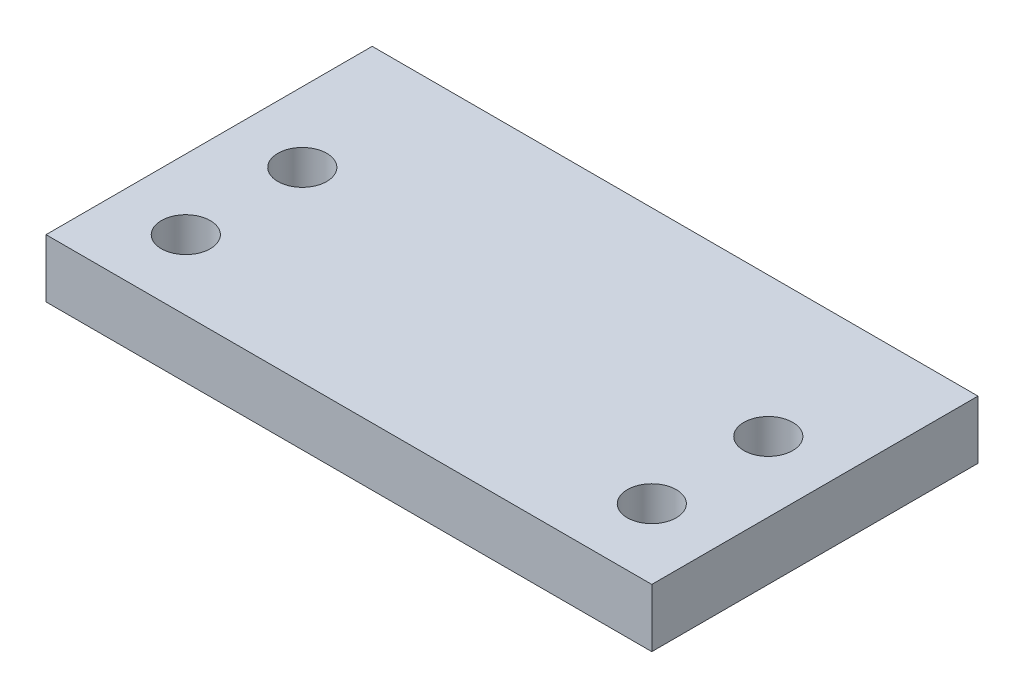
from build123d import *

# Parameters (mm, degrees)
SKETCH1_W           = 52
SKETCH1_H           = 28
SKETCH1_R           = 2.1
BOSS_EXTRUDE1_DEPTH = 5


with BuildPart() as part:
    # Sketch1 → Boss-Extrude1 (new body)
    with BuildSketch(Plane(origin=(0, 0, 0), x_dir=(1, 0, 0), z_dir=(0, 1, 0))):
        Rectangle(SKETCH1_W, SKETCH1_H)
        with Locations(Location((20, -8, 0), (0, 0, 270))):
            Circle(SKETCH1_R, mode=Mode.SUBTRACT)
        with Locations(Location((20, 2, 0), (0, 0, 90))):
            Circle(SKETCH1_R, mode=Mode.SUBTRACT)
        with Locations(Location((-20, -8, 0), (0, 0, 90))):
            Circle(SKETCH1_R, mode=Mode.SUBTRACT)
        with Locations(Location((-20, 2, 0), (0, 0, 270))):
            Circle(SKETCH1_R, mode=Mode.SUBTRACT)
    extrude(amount=BOSS_EXTRUDE1_DEPTH)


solid = part.part
